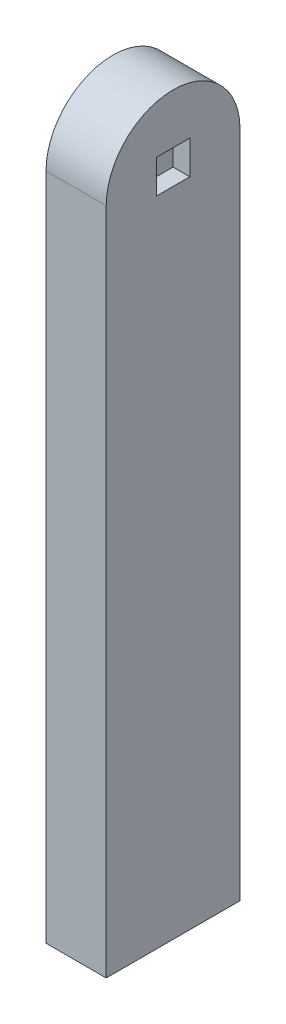
from build123d import *

# Parameters (mm, degrees)
BOSS_EXTRUDE1_START = -9
SKETCH2_W           = 10
SKETCH2_H           = 10
BOSS_EXTRUDE1_DEPTH = 5
BOSS_EXTRUDE2_START = -4
BOSS_EXTRUDE2_DEPTH = 4


with BuildPart() as part:
    # Sketch2 → Boss-Extrude1 (new body)
    with BuildSketch(Plane(origin=(0, 0, 0), x_dir=(0, 0, -1), z_dir=(1, 0, 0)).offset(BOSS_EXTRUDE1_START)):
        with BuildLine():
            Line((-20, 0), (-20, -200))
            Line((-20, -200), (20, -200))
            Line((20, -200), (20, 0))
            ThreePointArc((20, 0), (0, 20), (-20, 0))
        make_face()
        Rectangle(SKETCH2_W, SKETCH2_H, mode=Mode.SUBTRACT)
    extrude(amount=BOSS_EXTRUDE1_DEPTH)

    # Sketch2<6> → Boss-Extrude2 (add)
    with BuildSketch(Plane(origin=(0, 0, 0), x_dir=(0, 0, -1), z_dir=(1, 0, 0)).offset(BOSS_EXTRUDE2_START)):
        with BuildLine():
            Line((-20, 0), (-20, -200))
            Line((-20, -200), (20, -200))
            Line((20, -200), (20, 0))
            ThreePointArc((20, 0), (0, 20), (-20, 0))
        make_face()
        with BuildLine():
            Line((15, 0), (15, -195))
            Line((15, -195), (-15, -195))
            Line((-15, -195), (-15, 0))
            ThreePointArc((-15, 0), (0, 15), (15, 0))
        make_face(mode=Mode.SUBTRACT)
    extrude(amount=BOSS_EXTRUDE2_DEPTH)

    # Mirror1: part across plane


with BuildPart() as part_1:
    add(part.part)
    add(part.part.mirror(Plane(origin=(0, 0, 0), x_dir=(0, 0, 1), z_dir=(1, 0, 0))))


solid = part_1.part
